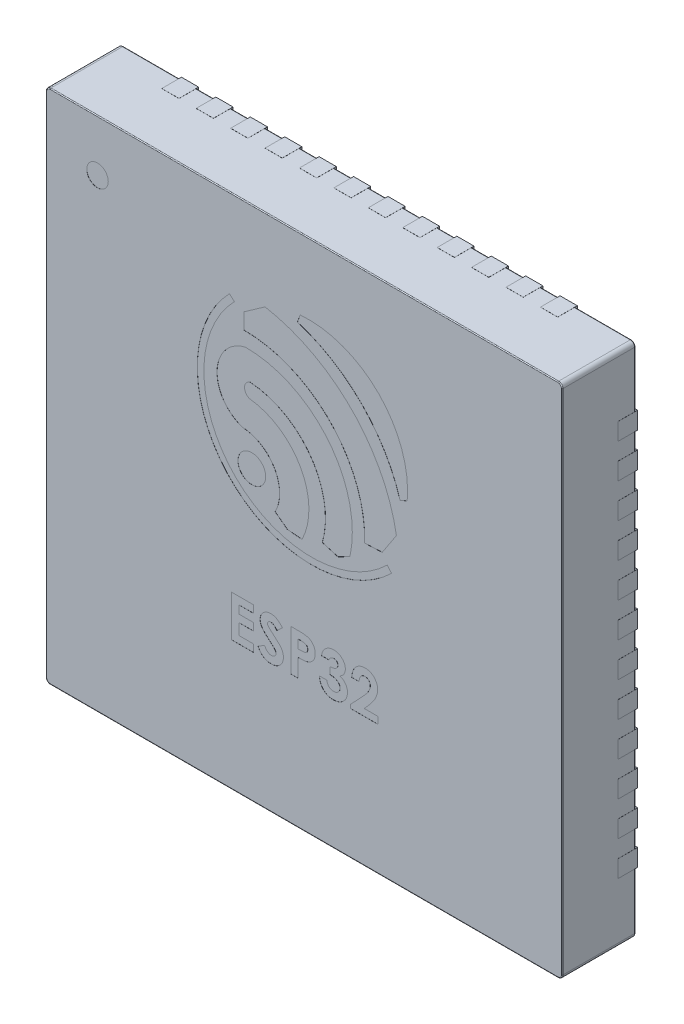
from build123d import *

# Parameters (mm, degrees)
SKETCH1_W                = 6
SKETCH1_H                = 6
BOSS_EXTRUDE1_DEPTH      = 0.85
FILLET1_R                = 0.05
FILLET2_R                = 0.01
BOSS_EXTRUDE2_DEPTH      = 0.025
BOSS_EXTRUDE2_DEPTH_BACK = 0.203
SKETCH2_W                = 0.2
SKETCH2_H                = 0.4
SKETCH2_W_2              = 0.4
SKETCH2_H_2              = 0.2
SKETCH3_R                = 0.125
SKETCH3_R_2              = 0.161208001
CUT_EXTRUDE1_DEPTH       = 0.001
BODY_MOVE_COPY1_ANGLE    = 180


with BuildPart() as part:
    # Sketch1 → Boss-Extrude1 (new body)
    with BuildSketch(Plane(origin=(0, 0, 0), x_dir=(1, 0, 0), z_dir=(0, 1, 0))):
        Rectangle(SKETCH1_W, SKETCH1_H)
    extrude(amount=BOSS_EXTRUDE1_DEPTH)

    # Fillet1
    fillet1_edges = [part.edges().sort_by_distance(p)[0] for p in [
        (3, 0.425, 3),
        (-3, 0.425, 3),
        (-3, 0.425, -3),
        (3, 0.425, -3),
    ]]
    fillet(fillet1_edges, radius=FILLET1_R)

    # Fillet2
    fillet2_edges = [part.edges().sort_by_distance(p)[0] for p in [
        (0, 0, -3),
        (0, 0.85, -3),
        (3, 0, 0),
        (0, 0, 3),
        (-3, 0, 0),
        (-2.985355339, 0, -2.985355339),
        (-2.985355339, 0, 2.985355339),
        (2.985355339, 0, 2.985355339),
        (2.985355339, 0, -2.985355339),
        (3, 0.85, 0),
        (-3, 0.85, 0),
        (0, 0.85, 3),
        (-2.985355339, 0.85, -2.985355339),
        (-2.985355339, 0.85, 2.985355339),
        (2.985355339, 0.85, 2.985355339),
        (2.985355339, 0.85, -2.985355339),
    ]]
    fillet(fillet2_edges, radius=FILLET2_R)

    # Sketch2 → Boss-Extrude2 (add, two sides: drawn at the far end of the back side and taken through both)
    with BuildSketch(Plane.XZ.offset(-BOSS_EXTRUDE2_DEPTH_BACK)):
        with BuildLine():
            Line((1.85, 2.15), (2.15, 1.85))
            Line((2.15, 1.85), (2.15, -2.05))
            ThreePointArc((2.15, -2.05), (2.120710678, -2.120710678), (2.05, -2.15))
            Line((2.05, -2.15), (-2.05, -2.15))
            ThreePointArc((-2.05, -2.15), (-2.120710678, -2.120710678), (-2.15, -2.05))
            Line((-2.15, -2.05), (-2.15, 2.05))
            ThreePointArc((-2.15, 2.05), (-2.120710678, 2.120710678), (-2.05, 2.15))
            Line((-2.05, 2.15), (1.85, 2.15))
        make_face()
        with Locations((-0.2, 2.801)):
            Rectangle(SKETCH2_W, SKETCH2_H)
        with Locations((-0.6, 2.801)):
            Rectangle(SKETCH2_W, SKETCH2_H)
        with Locations((-1, 2.801)):
            Rectangle(SKETCH2_W, SKETCH2_H)
        with Locations((-1.4, 2.801)):
            Rectangle(SKETCH2_W, SKETCH2_H)
        with Locations((-1.8, 2.801)):
            Rectangle(SKETCH2_W, SKETCH2_H)
        with Locations((-2.2, 2.801)):
            Rectangle(SKETCH2_W, SKETCH2_H)
        with Locations((2.2, 2.801)):
            Rectangle(SKETCH2_W, SKETCH2_H)
        with Locations((1.8, 2.801)):
            Rectangle(SKETCH2_W, SKETCH2_H)
        with Locations((1.4, 2.801)):
            Rectangle(SKETCH2_W, SKETCH2_H)
        with Locations((1, 2.801)):
            Rectangle(SKETCH2_W, SKETCH2_H)
        with Locations((0.6, 2.801)):
            Rectangle(SKETCH2_W, SKETCH2_H)
        with Locations((0.2, 2.801)):
            Rectangle(SKETCH2_W, SKETCH2_H)
        with Locations((0.2, -2.801)):
            Rectangle(SKETCH2_W, SKETCH2_H)
        with Locations((0.6, -2.801)):
            Rectangle(SKETCH2_W, SKETCH2_H)
        with Locations((1, -2.801)):
            Rectangle(SKETCH2_W, SKETCH2_H)
        with Locations((1.4, -2.801)):
            Rectangle(SKETCH2_W, SKETCH2_H)
        with Locations((1.8, -2.801)):
            Rectangle(SKETCH2_W, SKETCH2_H)
        with Locations((2.2, -2.801)):
            Rectangle(SKETCH2_W, SKETCH2_H)
        with Locations((-2.2, -2.801)):
            Rectangle(SKETCH2_W, SKETCH2_H)
        with Locations((-1.8, -2.801)):
            Rectangle(SKETCH2_W, SKETCH2_H)
        with Locations((-1.4, -2.801)):
            Rectangle(SKETCH2_W, SKETCH2_H)
        with Locations((-1, -2.801)):
            Rectangle(SKETCH2_W, SKETCH2_H)
        with Locations((-0.6, -2.801)):
            Rectangle(SKETCH2_W, SKETCH2_H)
        with Locations((-0.2, -2.801)):
            Rectangle(SKETCH2_W, SKETCH2_H)
        with Locations((2.801, 0.2)):
            Rectangle(SKETCH2_W_2, SKETCH2_H_2)
        with Locations((2.801, 0.6)):
            Rectangle(SKETCH2_W_2, SKETCH2_H_2)
        with Locations((2.801, 1)):
            Rectangle(SKETCH2_W_2, SKETCH2_H_2)
        with Locations((2.801, 1.4)):
            Rectangle(SKETCH2_W_2, SKETCH2_H_2)
        with Locations((2.801, 1.8)):
            Rectangle(SKETCH2_W_2, SKETCH2_H_2)
        with Locations((2.801, 2.2)):
            Rectangle(SKETCH2_W_2, SKETCH2_H_2)
        with Locations((2.801, -2.2)):
            Rectangle(SKETCH2_W_2, SKETCH2_H_2)
        with Locations((2.801, -1.8)):
            Rectangle(SKETCH2_W_2, SKETCH2_H_2)
        with Locations((2.801, -1.4)):
            Rectangle(SKETCH2_W_2, SKETCH2_H_2)
        with Locations((2.801, -1)):
            Rectangle(SKETCH2_W_2, SKETCH2_H_2)
        with Locations((2.801, -0.6)):
            Rectangle(SKETCH2_W_2, SKETCH2_H_2)
        with Locations((2.801, -0.2)):
            Rectangle(SKETCH2_W_2, SKETCH2_H_2)
        with Locations((-2.801, -0.2)):
            Rectangle(SKETCH2_W_2, SKETCH2_H_2)
        with Locations((-2.801, -0.6)):
            Rectangle(SKETCH2_W_2, SKETCH2_H_2)
        with Locations((-2.801, -1)):
            Rectangle(SKETCH2_W_2, SKETCH2_H_2)
        with Locations((-2.801, -1.4)):
            Rectangle(SKETCH2_W_2, SKETCH2_H_2)
        with Locations((-2.801, -1.8)):
            Rectangle(SKETCH2_W_2, SKETCH2_H_2)
        with Locations((-2.801, -2.2)):
            Rectangle(SKETCH2_W_2, SKETCH2_H_2)
        with Locations((-2.801, 2.2)):
            Rectangle(SKETCH2_W_2, SKETCH2_H_2)
        with Locations((-2.801, 1.8)):
            Rectangle(SKETCH2_W_2, SKETCH2_H_2)
        with Locations((-2.801, 1.4)):
            Rectangle(SKETCH2_W_2, SKETCH2_H_2)
        with Locations((-2.801, 1)):
            Rectangle(SKETCH2_W_2, SKETCH2_H_2)
        with Locations((-2.801, 0.6)):
            Rectangle(SKETCH2_W_2, SKETCH2_H_2)
        with Locations((-2.801, 0.2)):
            Rectangle(SKETCH2_W_2, SKETCH2_H_2)
    extrude(amount=BOSS_EXTRUDE2_DEPTH + BOSS_EXTRUDE2_DEPTH_BACK)

    # Sketch3 → Cut-Extrude1 (cut)
    # profile 1 of 11: a face of its own
    with BuildSketch(Plane(origin=(0, 0.85, 0), x_dir=(1, 0, 0), z_dir=(0, 1, 0))):
        with Locations(Location((2.4, -2.4, 0), (0, 0, 270))):
            Circle(SKETCH3_R)
    # profile 2 of 11: a face of its own
    with BuildSketch(Plane(origin=(0, 0.85, 0), x_dir=(1, 0, 0), z_dir=(0, 1, 0))):
        with Locations(Location((0.606882324, -0.344944849, 0), (0, 0, 270))):
            Circle(SKETCH3_R_2)
    # profile 3 of 11: a face of its own
    with BuildSketch(Plane(origin=(0, 0.85, 0), x_dir=(1, 0, 0), z_dir=(0, 1, 0))):
        with BuildLine():
            Line((-1.115573676, -0.887450984), (-1.198409676, -0.922730984))
            ThreePointArc((-1.198409676, -0.922730984), (-0.867285845, -1.837232763), (0.045496728, -2.173066751))
            Line((0.045496728, -2.173066751), (0.077070324, -2.085062984))
            ThreePointArc((0.077070324, -2.085062984), (-0.668558563, -1.634944508), (-1.115573676, -0.887450984))
        make_face()
    # profile 4 of 11: a face of its own
    with BuildSketch(Plane(origin=(0, 0.85, 0), x_dir=(1, 0, 0), z_dir=(0, 1, 0))):
        with BuildLine():
            Line((-0.704093677, -0.251582019), (-0.908249677, -0.260330019))
            Line((-0.908249677, -0.260330019), (-1.073237677, -0.512222019))
            ThreePointArc((-1.073237677, -0.512222019), (-0.552346402, -1.5215379), (0.45300867, -2.050033356))
            Line((0.45300867, -2.050033356), (0.70068867, -1.876261356))
            Line((0.70068867, -1.876261356), (0.70068867, -1.693705356))
            ThreePointArc((0.70068867, -1.693705356), (-0.306351206, -1.269404102), (-0.704093677, -0.251582019))
        make_face()
    # profile 5 of 11: a face of its own
    with BuildSketch(Plane(origin=(0, 0.85, 0), x_dir=(1, 0, 0), z_dir=(0, 1, 0))):
        with BuildLine():
            Line((0.809202324, -1.924862984), (0.866910324, -1.975910984))
            ThreePointArc((0.866910324, -1.975910984), (0.848943404, -0.110010505), (-1.017033157, -0.103774958))
            Line((-1.017033157, -0.103774958), (-0.965712771, -0.161249049))
            ThreePointArc((-0.965712771, -0.161249049), (0.794649013, -0.164558249), (0.809202324, -1.924862984))
        make_face()
    # profile 6 of 11: a face of its own
    with BuildSketch(Plane(origin=(0, 0.85, 0), x_dir=(1, 0, 0), z_dir=(0, 1, 0))):
        with BuildLine():
            Line((0.335841207, -0.047493963), (0.193785207, 0.060002037))
            Line((0.193785207, 0.060002037), (0.023217207, 0.075014037))
            ThreePointArc((0.023217207, 0.075014037), (0.038763671, -0.638382645), (0.631509575, -1.03565939))
            ThreePointArc((0.631509575, -1.03565939), (0.691855042, -1.121458494), (0.628324793, -1.204926866))
            ThreePointArc((0.628324793, -1.204926866), (-0.077644005, -0.809812461), (-0.212221493, -0.012067993))
            Line((-0.212221493, -0.012067993), (-0.392509493, 0.041608007))
            Line((-0.392509493, 0.041608007), (-0.532967065, -0.028692698))
            ThreePointArc((-0.532967065, -0.028692698), (-0.285180741, -1.069399636), (0.680002507, -1.530799993))
            ThreePointArc((0.680002507, -1.530799993), (1.011169584, -1.132075347), (0.715389074, -0.706438335))
            ThreePointArc((0.715389074, -0.706438335), (0.344455249, -0.481313122), (0.335841207, -0.047493963))
        make_face()
    # profile 7 of 11: a face of its own
    with BuildSketch(Plane(origin=(0, 0.85, 0), x_dir=(1, 0, 0), z_dir=(0, 1, 0))):
        with BuildLine():
            Line((-0.64, 1.175), (-0.553846154, 1.175))
            add(Edge.make_bspline(
                [(-0.553846154, 1.175), (-0.554218093, 1.168482849), (-0.55494484, 1.155748728), (-0.557838826, 1.137253152), (-0.561706703, 1.119772591), (-0.566912962, 1.103359597), (-0.573325637, 1.088007276), (-0.581104334, 1.073766481), (-0.590016807, 1.060535169), (-0.600242704, 1.048545392), (-0.611367007, 1.037766218), (-0.623361195, 1.028342782), (-0.636191198, 1.020454133), (-0.649771224, 1.013983038), (-0.664047933, 1.008805329), (-0.67916557, 1.005345433), (-0.694990743, 1.003001852), (-0.705824451, 1.002796812), (-0.711346154, 1.002692308)],
                knots=[0, 0, 0, 0, 1.198928049, 2.342633425, 3.435730849, 4.486331048, 5.502589352, 6.488331875, 7.46361919, 8.428949135, 9.378681775, 10.305958057, 11.226249248, 12.140413166, 13.066341608, 14.010670971, 14.986082777, 16, 16, 16, 16], degree=3))
            add(Edge.make_bspline(
                [(-0.711346154, 1.002692308), (-0.71812686, 1.002889923), (-0.731370203, 1.003275884), (-0.750552378, 1.006991978), (-0.768581303, 1.012716219), (-0.785278818, 1.020949312), (-0.800557409, 1.031378667), (-0.814235446, 1.043947381), (-0.826375703, 1.058501282), (-0.836577959, 1.074933995), (-0.84487609, 1.092395217), (-0.85086753, 1.110345239), (-0.854759067, 1.128422138), (-0.855176996, 1.14058988), (-0.855384615, 1.146634615)],
                knots=[0, 0, 0, 0, 1.075206757, 2.099977874, 3.089436832, 4.070080219, 5.043757236, 6.01602434, 7.009399377, 8.042659726, 9.078134622, 10.07077983, 11.041594984, 12, 12, 12, 12], degree=3))
            add(Edge.make_bspline(
                [(-0.855384615, 1.146634615), (-0.855304085, 1.15029111), (-0.855141998, 1.157650731), (-0.854014986, 1.168787644), (-0.852324244, 1.180131892), (-0.849775017, 1.191673748), (-0.846595925, 1.20341645), (-0.842739215, 1.215395129), (-0.838115484, 1.22754191), (-0.832801665, 1.239993347), (-0.826463032, 1.252790494), (-0.819079425, 1.266122589), (-0.810447107, 1.280026317), (-0.800650355, 1.294458391), (-0.789758179, 1.309530735), (-0.777604789, 1.32506484), (-0.76434584, 1.341236086), (-0.754932491, 1.352043554), (-0.750096154, 1.357596154)],
                knots=[0, 0, 0, 0, 0.728286467, 1.465860763, 2.227952348, 3.011875114, 3.818782069, 4.650637576, 5.517456182, 6.406927181, 7.346324104, 8.360844784, 9.441645378, 10.605053135, 11.834886952, 13.145197974, 14.533275831, 16, 16, 16, 16], degree=3))
            Line((-0.750096154, 1.357596154), (-0.7, 1.415))
            Line((-0.7, 1.415), (-0.861538462, 1.415))
            Line((-0.861538462, 1.415), (-0.861538462, 1.495))
            Line((-0.861538462, 1.495), (-0.541538462, 1.495))
            Line((-0.541538462, 1.495), (-0.541538462, 1.451346154))
            Line((-0.541538462, 1.451346154), (-0.683653846, 1.300096154))
            add(Edge.make_bspline(
                [(-0.683653846, 1.300096154), (-0.687768517, 1.295684188), (-0.695737414, 1.287139519), (-0.707075275, 1.274590047), (-0.717338813, 1.262683468), (-0.726298538, 1.251281705), (-0.734496538, 1.240770808), (-0.741354768, 1.230753423), (-0.747327446, 1.221511659), (-0.75356654, 1.210246316), (-0.759627984, 1.196911868), (-0.765186231, 1.181559531), (-0.768540405, 1.166875944), (-0.769006952, 1.157290673), (-0.769230769, 1.152692308)],
                knots=[0, 0, 0, 0, 1.246192343, 2.413505005, 3.49357156, 4.492416076, 5.408771964, 6.246246772, 6.999304986, 7.680960093, 8.904522682, 10.020616941, 11.0504258, 12, 12, 12, 12], degree=3))
            add(Edge.make_bspline(
                [(-0.769230769, 1.152692308), (-0.769066474, 1.148242262), (-0.768748126, 1.139619584), (-0.765162536, 1.127389555), (-0.759797607, 1.116232484), (-0.752008747, 1.106656604), (-0.742607792, 1.09871909), (-0.731682321, 1.092902576), (-0.719432933, 1.089483935), (-0.710855054, 1.0890628), (-0.706442308, 1.088846154)],
                knots=[0, 0, 0, 0, 1.061596218, 2.057012874, 3.024113775, 4.006148568, 4.986025304, 5.949989669, 6.945406325, 8, 8, 8, 8], degree=3))
            add(Edge.make_bspline(
                [(-0.706442308, 1.088846154), (-0.704163076, 1.088926769), (-0.699676043, 1.089085473), (-0.693080454, 1.090141924), (-0.686804278, 1.092003808), (-0.680777657, 1.09449847), (-0.675064908, 1.097805162), (-0.669680441, 1.101881188), (-0.664567524, 1.106622965), (-0.659749606, 1.112015667), (-0.655364672, 1.118033925), (-0.65146999, 1.124622772), (-0.648249736, 1.131778121), (-0.645414508, 1.139405508), (-0.643227844, 1.147586859), (-0.641635681, 1.156273209), (-0.640425266, 1.165450427), (-0.640144334, 1.171758901), (-0.64, 1.175)],
                knots=[0, 0, 0, 0, 0.903469896, 1.778625579, 2.63899355, 3.493148037, 4.358286772, 5.247621495, 6.164656832, 7.118446693, 8.109501108, 9.111810964, 10.146451449, 11.215617525, 12.33435995, 13.498009769, 14.714554818, 16, 16, 16, 16], degree=3))
        make_face()
    # profile 8 of 11: a face of its own
    with BuildSketch(Plane(origin=(0, 0.85, 0), x_dir=(1, 0, 0), z_dir=(0, 1, 0))):
        with BuildLine():
            Line((-0.289230769, 1.131923077), (-0.203076923, 1.131923077))
            add(Edge.make_bspline(
                [(-0.203076923, 1.131923077), (-0.203681407, 1.127615611), (-0.204862115, 1.119202064), (-0.207764618, 1.106992206), (-0.211121188, 1.095381532), (-0.215413765, 1.084432352), (-0.220368772, 1.07415647), (-0.226146982, 1.064544691), (-0.232480283, 1.055459077), (-0.237438861, 1.050014349), (-0.239903846, 1.047307692)],
                knots=[0, 0, 0, 0, 1.1115466, 2.171125598, 3.205689823, 4.19946166, 5.17440286, 6.118867946, 7.064860634, 8, 8, 8, 8], degree=3))
            add(Edge.make_bspline(
                [(-0.239903846, 1.047307692), (-0.243450492, 1.043730934), (-0.250440557, 1.036681518), (-0.262121777, 1.027651996), (-0.274365852, 1.019837558), (-0.287418343, 1.013642215), (-0.301076144, 1.008627803), (-0.315447866, 1.005259611), (-0.33047478, 1.003024786), (-0.340728759, 1.002804648), (-0.345961538, 1.002692308)],
                knots=[0, 0, 0, 0, 1.01925491, 2.00884431, 2.983262333, 3.955970413, 4.92937149, 5.924503185, 6.940838805, 8, 8, 8, 8], degree=3))
            add(Edge.make_bspline(
                [(-0.345961538, 1.002692308), (-0.350613748, 1.002802137), (-0.359759056, 1.00301804), (-0.373200356, 1.00475119), (-0.386015512, 1.007790943), (-0.398339982, 1.011765352), (-0.409992513, 1.017173199), (-0.421230289, 1.023450558), (-0.431739326, 1.031150001), (-0.441544213, 1.039849595), (-0.450551871, 1.049259059), (-0.458352543, 1.059317002), (-0.46505892, 1.069754753), (-0.470584088, 1.08065903), (-0.474832191, 1.092048285), (-0.477780501, 1.103856723), (-0.479710241, 1.116058289), (-0.479902493, 1.124351529), (-0.48, 1.128557692)],
                knots=[0, 0, 0, 0, 1.091422571, 2.145516843, 3.172569842, 4.178562979, 5.178154469, 6.181868002, 7.194278174, 8.227918432, 9.254613415, 10.245994977, 11.209837596, 12.161663635, 13.10878368, 14.055455738, 15.013766427, 16, 16, 16, 16], degree=3))
            add(Edge.make_bspline(
                [(-0.48, 1.128557692), (-0.479796058, 1.133765751), (-0.479393329, 1.144050226), (-0.476208334, 1.159072703), (-0.471088272, 1.173404248), (-0.463808303, 1.186875053), (-0.454666253, 1.199471085), (-0.443455261, 1.210752421), (-0.430488181, 1.220893772), (-0.420753892, 1.226343804), (-0.415769231, 1.229134615)],
                knots=[0, 0, 0, 0, 0.992776698, 1.96045919, 2.915875678, 3.886951799, 4.871409521, 5.874469288, 6.911574252, 8, 8, 8, 8], degree=3))
            add(Edge.make_bspline(
                [(-0.415769231, 1.229134615), (-0.419190754, 1.230257788), (-0.425913893, 1.232464773), (-0.4354681, 1.236814088), (-0.444560537, 1.241557069), (-0.452983263, 1.247093992), (-0.460967252, 1.253041079), (-0.4682599, 1.259718089), (-0.475050049, 1.266953631), (-0.481169718, 1.27482468), (-0.486640986, 1.283200368), (-0.491462761, 1.291930154), (-0.495509137, 1.301045944), (-0.49890524, 1.310480751), (-0.501496372, 1.320327427), (-0.503319327, 1.330552603), (-0.504373384, 1.341131643), (-0.504534113, 1.348298986), (-0.504615385, 1.351923077)],
                knots=[0, 0, 0, 0, 1.059375415, 2.081625174, 3.086260357, 4.075579879, 5.045586876, 6.014170127, 6.982201689, 7.963705737, 8.945119069, 9.924852636, 10.896327119, 11.878239286, 12.873838556, 13.889973282, 14.933087432, 16, 16, 16, 16], degree=3))
            add(Edge.make_bspline(
                [(-0.504615385, 1.351923077), (-0.504464736, 1.357251355), (-0.50416756, 1.3677621), (-0.501899133, 1.383192937), (-0.498255661, 1.397984064), (-0.49313668, 1.412154127), (-0.486434327, 1.425660569), (-0.478339257, 1.438594215), (-0.468752569, 1.450853435), (-0.457819616, 1.462329617), (-0.445779851, 1.472861477), (-0.432810059, 1.482157458), (-0.418902097, 1.489822794), (-0.404387716, 1.496374024), (-0.388941144, 1.501236219), (-0.37276187, 1.504796829), (-0.355731835, 1.506963222), (-0.344108961, 1.507191241), (-0.338173077, 1.507307692)],
                knots=[0, 0, 0, 0, 1.005301618, 1.9830924, 2.936709333, 3.876255674, 4.820386332, 5.77704884, 6.75110905, 7.752325838, 8.764085485, 9.766124222, 10.757295257, 11.756573224, 12.766631673, 13.80722022, 14.880131728, 16, 16, 16, 16], degree=3))
            add(Edge.make_bspline(
                [(-0.338173077, 1.507307692), (-0.332557688, 1.507185227), (-0.321577539, 1.506945761), (-0.305517083, 1.504872089), (-0.290251965, 1.5015294), (-0.275748701, 1.496809586), (-0.26206904, 1.49072862), (-0.249133283, 1.483388794), (-0.23708265, 1.474565214), (-0.225861659, 1.464466061), (-0.215565441, 1.453291472), (-0.206591885, 1.440950363), (-0.198782525, 1.427712397), (-0.192085822, 1.413549106), (-0.186853543, 1.398334116), (-0.18269245, 1.382203301), (-0.179795497, 1.365086911), (-0.178911997, 1.353311484), (-0.178461538, 1.347307692)],
                knots=[0, 0, 0, 0, 1.066693477, 2.085777942, 3.071407889, 4.032495163, 4.978645371, 5.911608997, 6.853298848, 7.810770565, 8.776420673, 9.735131334, 10.704462168, 11.693492242, 12.70668109, 13.756973703, 14.856375978, 16, 16, 16, 16], degree=3))
            Line((-0.178461538, 1.347307692), (-0.264615385, 1.347307692))
            add(Edge.make_bspline(
                [(-0.264615385, 1.347307692), (-0.265161439, 1.350326471), (-0.266225023, 1.356206334), (-0.268297603, 1.364719905), (-0.271005567, 1.372575365), (-0.274101574, 1.379830425), (-0.277524573, 1.386559542), (-0.281614463, 1.392582768), (-0.285999732, 1.398136815), (-0.292591792, 1.404520818), (-0.301789225, 1.411215795), (-0.314242008, 1.417145174), (-0.328157744, 1.420517434), (-0.337866493, 1.420936991), (-0.342884615, 1.421153846)],
                knots=[0, 0, 0, 0, 0.928450228, 1.808400301, 2.64896863, 3.43999153, 4.194978884, 4.9294959, 5.640047715, 6.332896648, 7.70085756, 9.063442004, 10.482192841, 12, 12, 12, 12], degree=3))
            add(Edge.make_bspline(
                [(-0.342884615, 1.421153846), (-0.345547818, 1.421108018), (-0.350764437, 1.421018252), (-0.358428132, 1.420028938), (-0.365724068, 1.418387791), (-0.372728457, 1.416184924), (-0.37934576, 1.413280039), (-0.385660575, 1.409825555), (-0.39156054, 1.405626007), (-0.39706424, 1.400890416), (-0.402045134, 1.395675697), (-0.406550079, 1.39022858), (-0.410165739, 1.384326489), (-0.413167031, 1.378202835), (-0.415642737, 1.371859201), (-0.417195988, 1.36515125), (-0.418358881, 1.358213431), (-0.418426978, 1.353466738), (-0.418461538, 1.351057692)],
                knots=[0, 0, 0, 0, 1.110416125, 2.175056767, 3.216269732, 4.226816172, 5.232753079, 6.226173397, 7.223992381, 8.247806573, 9.250094092, 10.229378924, 11.190237183, 12.128982156, 13.072570213, 14.022671385, 14.996464856, 16, 16, 16, 16], degree=3))
            add(Edge.make_bspline(
                [(-0.418461538, 1.351057692), (-0.418373787, 1.348422095), (-0.418200143, 1.34320675), (-0.416672083, 1.335563911), (-0.414384804, 1.328183647), (-0.411095272, 1.32112685), (-0.406790772, 1.314435023), (-0.401556942, 1.308052742), (-0.395346436, 1.302030821), (-0.388367225, 1.296193878), (-0.380337712, 1.291084246), (-0.37158214, 1.286379039), (-0.361884809, 1.282632535), (-0.351478359, 1.279287029), (-0.340167125, 1.27684332), (-0.328021004, 1.275069009), (-0.315059688, 1.273748291), (-0.306125281, 1.273558814), (-0.301538462, 1.273461538)],
                knots=[0, 0, 0, 0, 0.809868251, 1.602574917, 2.388262527, 3.182133002, 3.988875265, 4.829537611, 5.714850619, 6.646378958, 7.622533229, 8.636771727, 9.698525113, 10.814716514, 11.996253919, 13.252421425, 14.589425562, 16, 16, 16, 16], degree=3))
            Line((-0.301538462, 1.273461538), (-0.301538462, 1.193461538))
            add(Edge.make_bspline(
                [(-0.301538462, 1.193461538), (-0.307249897, 1.192976554), (-0.317934862, 1.192069245), (-0.332757775, 1.189924956), (-0.345303094, 1.187121393), (-0.355705675, 1.183530028), (-0.364472717, 1.179315359), (-0.37193644, 1.174315049), (-0.378581011, 1.168778378), (-0.384005829, 1.162418926), (-0.388389582, 1.155705831), (-0.391493602, 1.148657578), (-0.393554086, 1.141430857), (-0.393749384, 1.136487768), (-0.393846154, 1.134038462)],
                knots=[0, 0, 0, 0, 1.700278244, 3.18088388, 4.44026007, 5.507838349, 6.439172496, 7.317391478, 8.167251366, 8.996486918, 9.787781501, 10.536992524, 11.275078289, 12, 12, 12, 12], degree=3))
            add(Edge.make_bspline(
                [(-0.393846154, 1.134038462), (-0.393683048, 1.130911417), (-0.393364701, 1.12480809), (-0.390777332, 1.116094491), (-0.386573587, 1.10819823), (-0.380654826, 1.101391529), (-0.373413087, 1.095771541), (-0.364976794, 1.091675312), (-0.355488985, 1.089225142), (-0.348829019, 1.088975344), (-0.345384615, 1.088846154)],
                knots=[0, 0, 0, 0, 1.008776249, 1.968917671, 2.909425455, 3.878736958, 4.86052431, 5.85160606, 6.888892716, 8, 8, 8, 8], degree=3))
            add(Edge.make_bspline(
                [(-0.345384615, 1.088846154), (-0.342262803, 1.088999463), (-0.33606817, 1.089303677), (-0.32701342, 1.091584349), (-0.31842433, 1.095384767), (-0.310521174, 1.100721632), (-0.303323388, 1.107065144), (-0.297288191, 1.114517249), (-0.292375167, 1.12278647), (-0.290283011, 1.128865602), (-0.289230769, 1.131923077)],
                knots=[0, 0, 0, 0, 0.988439209, 1.961366134, 2.938893463, 3.950078543, 4.971412263, 5.967491143, 6.977757845, 8, 8, 8, 8], degree=3))
        make_face()
    # profile 9 of 11: a face of its own
    with BuildSketch(Plane(origin=(0, 0.85, 0), x_dir=(1, 0, 0), z_dir=(0, 1, 0))):
        with BuildLine():
            Line((0.153846154, 1.015), (0.057692308, 1.015))
            add(Edge.make_bspline(
                [(0.057692308, 1.015), (0.05140974, 1.015028122), (0.03928935, 1.015082375), (0.021810752, 1.015740271), (0.005685886, 1.016919257), (-0.009081531, 1.018376307), (-0.022485461, 1.020419002), (-0.034542585, 1.022760892), (-0.045255737, 1.025613667), (-0.054744662, 1.02900092), (-0.063263293, 1.032990867), (-0.071315194, 1.037252571), (-0.078779177, 1.042304163), (-0.085830477, 1.047781511), (-0.092415753, 1.05379857), (-0.098583803, 1.060331556), (-0.104271114, 1.067475415), (-0.109442031, 1.07518093), (-0.114135426, 1.083291224), (-0.118235207, 1.09182479), (-0.121560895, 1.100794047), (-0.124350684, 1.110141266), (-0.126591483, 1.11986596), (-0.128083027, 1.130027958), (-0.12909616, 1.1405563), (-0.129185555, 1.147721896), (-0.129230769, 1.151346154)],
                knots=[0, 0, 0, 0, 1.698787518, 3.27731721, 4.728409951, 6.070286353, 7.288646904, 8.393455548, 9.389990496, 10.283725379, 11.113616976, 11.931887102, 12.744353494, 13.547053751, 14.344590688, 15.153907614, 15.974148981, 16.810666655, 17.660988447, 18.506082349, 19.367288142, 20.244738011, 21.142497992, 22.06302001, 23.020302899, 24, 24, 24, 24], degree=3))
            add(Edge.make_bspline(
                [(-0.129230769, 1.151346154), (-0.129165633, 1.1553557), (-0.129037632, 1.16323495), (-0.127773329, 1.174782984), (-0.12563483, 1.185800483), (-0.122771978, 1.196334514), (-0.119037788, 1.206362031), (-0.114357597, 1.215817161), (-0.109004101, 1.224818385), (-0.102684085, 1.233201069), (-0.095700447, 1.241007884), (-0.088180665, 1.248323789), (-0.079899106, 1.254848086), (-0.071151362, 1.260919965), (-0.061687137, 1.266183033), (-0.051786837, 1.271056413), (-0.041199363, 1.275191923), (-0.033831586, 1.277361548), (-0.030096154, 1.278461538)],
                knots=[0, 0, 0, 0, 1.101767505, 2.165108537, 3.187936629, 4.183892551, 5.162396277, 6.123736501, 7.080098904, 8.036826416, 9.0040019, 9.957275584, 10.916231297, 11.898534744, 12.880877694, 13.889532316, 14.930001539, 16, 16, 16, 16], degree=3))
            add(Edge.make_bspline(
                [(-0.030096154, 1.278461538), (-0.027635506, 1.279073752), (-0.022304952, 1.280400002), (-0.013484348, 1.281746479), (-0.003319528, 1.282984483), (0.008222378, 1.284048396), (0.021148023, 1.28477161), (0.035444892, 1.285336407), (0.051119465, 1.285747073), (0.062018943, 1.285761646), (0.067692308, 1.285769231)],
                knots=[0, 0, 0, 0, 0.618981996, 1.340914327, 2.176866532, 3.120127938, 4.170906482, 5.338178032, 6.614476169, 8, 8, 8, 8], degree=3))
            Line((0.067692308, 1.285769231), (0.067692308, 1.495))
            Line((0.067692308, 1.495), (0.153846154, 1.495))
            Line((0.153846154, 1.495), (0.153846154, 1.015))
        make_face()
        with BuildLine():
            Line((0.067692308, 1.199615385), (0.037211538, 1.199615385))
            add(Edge.make_bspline(
                [(0.037211538, 1.199615385), (0.031664991, 1.199580347), (0.02145926, 1.199515876), (0.007523095, 1.198578626), (-0.003679948, 1.197153636), (-0.012520841, 1.19509319), (-0.019504256, 1.19202518), (-0.02545485, 1.188324842), (-0.03074158, 1.183878216), (-0.035148485, 1.178547402), (-0.038739687, 1.172599912), (-0.041258514, 1.165990835), (-0.042848289, 1.158825791), (-0.042999276, 1.153822834), (-0.043076923, 1.15125)],
                knots=[0, 0, 0, 0, 1.862351722, 3.426754836, 4.68713255, 5.653025869, 6.462861518, 7.236406327, 7.999926698, 8.771672214, 9.54880311, 10.322347919, 11.137246204, 12, 12, 12, 12], degree=3))
            add(Edge.make_bspline(
                [(-0.043076923, 1.15125), (-0.043001697, 1.149001586), (-0.042855742, 1.144639123), (-0.041768734, 1.138347435), (-0.040081643, 1.132493787), (-0.037503251, 1.127159778), (-0.034372848, 1.122220995), (-0.030401543, 1.117831186), (-0.025821811, 1.113848325), (-0.022280117, 1.111742789), (-0.020480769, 1.110673077)],
                knots=[0, 0, 0, 0, 1.102449765, 2.139017612, 3.12397484, 4.080535277, 5.035673127, 5.982361139, 6.974944601, 8, 8, 8, 8], degree=3))
            add(Edge.make_bspline(
                [(-0.020480769, 1.110673077), (-0.018957003, 1.109902465), (-0.015730878, 1.108270921), (-0.010236475, 1.106374132), (-0.003896018, 1.104773982), (0.003333299, 1.103445872), (0.011422636, 1.102415121), (0.020370549, 1.101626855), (0.030190206, 1.101309862), (0.03701919, 1.101207286), (0.040576923, 1.101153846)],
                knots=[0, 0, 0, 0, 0.656809284, 1.390599849, 2.23162475, 3.173112763, 4.218524733, 5.370385145, 6.63003504, 8, 8, 8, 8], degree=3))
            Line((0.040576923, 1.101153846), (0.067692308, 1.101153846))
            Line((0.067692308, 1.101153846), (0.067692308, 1.199615385))
        make_face(mode=Mode.SUBTRACT)
    # profile 10 of 11: a face of its own
    with BuildSketch(Plane(origin=(0, 0.85, 0), x_dir=(1, 0, 0), z_dir=(0, 1, 0))):
        with BuildLine():
            Line((0.252307692, 1.079134615), (0.316730769, 1.138076923))
            add(Edge.make_bspline(
                [(0.316730769, 1.138076923), (0.319489847, 1.134183513), (0.32478689, 1.126708709), (0.333381476, 1.116710696), (0.341924716, 1.108125696), (0.350591284, 1.101199162), (0.35923197, 1.095623084), (0.368030349, 1.091777038), (0.376885202, 1.089303623), (0.382837421, 1.088997123), (0.385769231, 1.088846154)],
                knots=[0, 0, 0, 0, 1.299459705, 2.494781419, 3.587730629, 4.594196874, 5.512431013, 6.380462003, 7.202284646, 8, 8, 8, 8], degree=3))
            add(Edge.make_bspline(
                [(0.385769231, 1.088846154), (0.388505059, 1.0889392), (0.393787223, 1.089118849), (0.401282266, 1.090994402), (0.408017828, 1.094025193), (0.413814493, 1.098211749), (0.418477783, 1.103211711), (0.42210377, 1.108534414), (0.424210838, 1.114337914), (0.424481427, 1.118318055), (0.424615385, 1.120288462)],
                knots=[0, 0, 0, 0, 1.184157716, 2.286297433, 3.324836695, 4.370048774, 5.362957217, 6.276446515, 7.146738784, 8, 8, 8, 8], degree=3))
            add(Edge.make_bspline(
                [(0.424615385, 1.120288462), (0.42453059, 1.122286357), (0.424359824, 1.126309841), (0.422710463, 1.132206757), (0.420224404, 1.137968731), (0.417848874, 1.141476319), (0.416634615, 1.143269231)],
                knots=[0, 0, 0, 0, 0.967525499, 1.948461899, 2.951351359, 4, 4, 4, 4], degree=3))
            add(Edge.make_bspline(
                [(0.416634615, 1.143269231), (0.415526272, 1.144658696), (0.41296027, 1.147875544), (0.408216127, 1.153051896), (0.402012875, 1.159128646), (0.3946127, 1.166411984), (0.385737887, 1.174618998), (0.375578984, 1.183987315), (0.363909964, 1.194198698), (0.355734626, 1.201407469), (0.351442308, 1.205192308)],
                knots=[0, 0, 0, 0, 0.473849886, 1.097042329, 1.870584189, 2.789244661, 3.865562256, 5.093556389, 6.47402294, 8, 8, 8, 8], degree=3))
            add(Edge.make_bspline(
                [(0.351442308, 1.205192308), (0.347403696, 1.208685736), (0.33973925, 1.215315537), (0.328848085, 1.224740949), (0.319214247, 1.233182704), (0.31092535, 1.240704016), (0.303733703, 1.246995148), (0.297957375, 1.252443139), (0.293349153, 1.256809662), (0.290732222, 1.259450067), (0.289615385, 1.260576923)],
                knots=[0, 0, 0, 0, 1.543627419, 2.929484142, 4.163674036, 5.24627963, 6.164986907, 6.925413438, 7.541394495, 8, 8, 8, 8], degree=3))
            add(Edge.make_bspline(
                [(0.289615385, 1.260576923), (0.285375723, 1.265161543), (0.277225604, 1.273974794), (0.266654086, 1.287669533), (0.257859606, 1.30093504), (0.251049181, 1.314145908), (0.246109959, 1.327575155), (0.242514381, 1.341414382), (0.240359179, 1.355861463), (0.240120647, 1.365697894), (0.24, 1.370673077)],
                knots=[0, 0, 0, 0, 1.206413378, 2.319150186, 3.339784753, 4.27899982, 5.184598145, 6.099639703, 7.038813909, 8, 8, 8, 8], degree=3))
            add(Edge.make_bspline(
                [(0.24, 1.370673077), (0.240085979, 1.375520823), (0.240254674, 1.38503228), (0.242318621, 1.398951527), (0.245265896, 1.412270379), (0.249807299, 1.42485541), (0.255389041, 1.436855761), (0.262191839, 1.448275468), (0.270508938, 1.458847926), (0.279746812, 1.468858411), (0.290124588, 1.477843864), (0.30128404, 1.4857657), (0.313246418, 1.492454305), (0.325920561, 1.497966404), (0.339465422, 1.502056991), (0.353667027, 1.505149713), (0.368668461, 1.507014478), (0.378904951, 1.507208546), (0.384134615, 1.507307692)],
                knots=[0, 0, 0, 0, 1.043039441, 2.046482205, 3.024244422, 3.976033659, 4.920890471, 5.871402525, 6.830893638, 7.812473116, 8.800703348, 9.781190227, 10.754606487, 11.746997808, 12.751247331, 13.796362838, 14.874195872, 16, 16, 16, 16], degree=3))
            add(Edge.make_bspline(
                [(0.384134615, 1.507307692), (0.388239918, 1.507234941), (0.39637077, 1.507090851), (0.408353852, 1.505912064), (0.41992704, 1.504015624), (0.43106722, 1.501276519), (0.44184486, 1.497885044), (0.452142999, 1.493474916), (0.462098556, 1.488487643), (0.471678425, 1.482708202), (0.480803221, 1.475995942), (0.489735847, 1.468615792), (0.498159632, 1.460162982), (0.506396427, 1.450945663), (0.514102221, 1.440696694), (0.521683069, 1.429724477), (0.528768972, 1.417766713), (0.533147937, 1.409379934), (0.535384615, 1.405096154)],
                knots=[0, 0, 0, 0, 1.017088714, 2.014418954, 2.980620591, 3.920647918, 4.854987948, 5.776890852, 6.693269322, 7.612671471, 8.545186947, 9.498010697, 10.480815007, 11.499174288, 12.558697099, 13.655746277, 14.802607237, 16, 16, 16, 16], degree=3))
            Line((0.535384615, 1.405096154), (0.459615385, 1.359615385))
            add(Edge.make_bspline(
                [(0.459615385, 1.359615385), (0.456817833, 1.364478198), (0.451454689, 1.373800627), (0.442366339, 1.386326491), (0.433055788, 1.397052821), (0.423307785, 1.405790027), (0.413240862, 1.412654937), (0.402806393, 1.417561078), (0.391997048, 1.420597974), (0.384634213, 1.420968849), (0.380961538, 1.421153846)],
                knots=[0, 0, 0, 0, 1.283663364, 2.460892379, 3.537111102, 4.529833553, 5.449777664, 6.316464042, 7.160231139, 8, 8, 8, 8], degree=3))
            add(Edge.make_bspline(
                [(0.380961538, 1.421153846), (0.377225215, 1.421004203), (0.369976203, 1.420713874), (0.359612131, 1.417979265), (0.350068314, 1.413782001), (0.341863055, 1.407677727), (0.334895213, 1.400717078), (0.329899986, 1.392866563), (0.326659757, 1.384474459), (0.326323143, 1.37861836), (0.326153846, 1.375673077)],
                knots=[0, 0, 0, 0, 1.13537643, 2.202795631, 3.242191317, 4.290390765, 5.297919085, 6.223733717, 7.106639842, 8, 8, 8, 8], degree=3))
            add(Edge.make_bspline(
                [(0.326153846, 1.375673077), (0.326312313, 1.372934346), (0.326634224, 1.367370876), (0.328992414, 1.359094089), (0.332709919, 1.350857436), (0.336976193, 1.344030008), (0.341424014, 1.338339062), (0.34578373, 1.33348226), (0.350950748, 1.328004074), (0.357056725, 1.32205389), (0.363982903, 1.315517304), (0.371751955, 1.308409858), (0.380447547, 1.300789488), (0.386593856, 1.295598779), (0.389807692, 1.292884615)],
                knots=[0, 0, 0, 0, 0.916057066, 1.860882232, 2.859899639, 3.934694552, 4.546382938, 5.276161949, 6.118633209, 7.067046139, 8.129668089, 9.306861125, 10.591787583, 12, 12, 12, 12], degree=3))
            add(Edge.make_bspline(
                [(0.389807692, 1.292884615), (0.395917095, 1.287715136), (0.407642887, 1.27779334), (0.424215879, 1.26314206), (0.439139231, 1.2494389), (0.452313417, 1.236574233), (0.46377757, 1.224630254), (0.473657895, 1.213711822), (0.48179473, 1.203604827), (0.490232129, 1.191533218), (0.498475716, 1.177030608), (0.505481591, 1.159500323), (0.510009372, 1.141991987), (0.510518595, 1.130218099), (0.510769231, 1.124423077)],
                knots=[0, 0, 0, 0, 1.345685333, 2.582777463, 3.719355561, 4.752181389, 5.678433858, 6.502864483, 7.227563063, 7.858499643, 8.978226409, 10.023061349, 11.026965269, 12, 12, 12, 12], degree=3))
            add(Edge.make_bspline(
                [(0.510769231, 1.124423077), (0.510664943, 1.120313655), (0.510459484, 1.112217653), (0.508632189, 1.100312266), (0.505888525, 1.088829997), (0.501945712, 1.077773752), (0.496657318, 1.067268084), (0.490410757, 1.057142958), (0.483028159, 1.04742932), (0.474566918, 1.038342648), (0.465278804, 1.029989712), (0.455372127, 1.022661333), (0.444938417, 1.016464478), (0.433946033, 1.011416166), (0.422414426, 1.00747672), (0.410332947, 1.00469265), (0.397738617, 1.0030324), (0.389171701, 1.002807084), (0.384807692, 1.002692308)],
                knots=[0, 0, 0, 0, 1.010806554, 1.991397492, 2.957573065, 3.913225829, 4.872777376, 5.846906201, 6.837692339, 7.870332167, 8.898170327, 9.907899016, 10.8981826, 11.879407896, 12.8797257, 13.891947133, 14.926152479, 16, 16, 16, 16], degree=3))
            add(Edge.make_bspline(
                [(0.384807692, 1.002692308), (0.379152488, 1.002899751), (0.367886719, 1.003312999), (0.351225025, 1.00652761), (0.334942566, 1.01163626), (0.321781223, 1.01765402), (0.311399083, 1.023669271), (0.303422799, 1.029094993), (0.295243206, 1.035325582), (0.287010466, 1.042542355), (0.278412392, 1.050328137), (0.269883278, 1.059217237), (0.261005465, 1.068754204), (0.25525774, 1.075613862), (0.252307692, 1.079134615)],
                knots=[0, 0, 0, 0, 1.282890948, 2.555655204, 3.837225328, 5.149160694, 5.83044799, 6.558852598, 7.337307105, 8.162686284, 9.043076448, 9.969084596, 10.957622644, 12, 12, 12, 12], degree=3))
        make_face()
    # profile 11 of 11: a face of its own
    with BuildSketch(Plane(origin=(0, 0.85, 0), x_dir=(1, 0, 0), z_dir=(0, 1, 0))):
        Polygon((0.843076923, 1.015), (0.584615385, 1.015), (0.584615385, 1.101153846), (0.756923077, 1.101153846), (0.756923077, 1.193461538), (0.584615385, 1.193461538), (0.584615385, 1.279615385), (0.756923077, 1.279615385), (0.756923077, 1.408846154), (0.584615385, 1.408846154), (0.584615385, 1.495), (0.843076923, 1.495), align=None)
    extrude(amount=-CUT_EXTRUDE1_DEPTH, mode=Mode.SUBTRACT)


with BuildPart() as part_1:
    # Body-Move/Copy1: moved
    add(part.part.rotate(Axis((0, 0, 0), (-4.937700262164522e-15, 0.7071067811865462, 0.7071067811865488)), BODY_MOVE_COPY1_ANGLE))


with BuildPart() as part_2:
    # Body-Move/Copy2: moved
    add(part_1.part.moved(Location((0, 0, 0.025))))


solid = part_2.part
